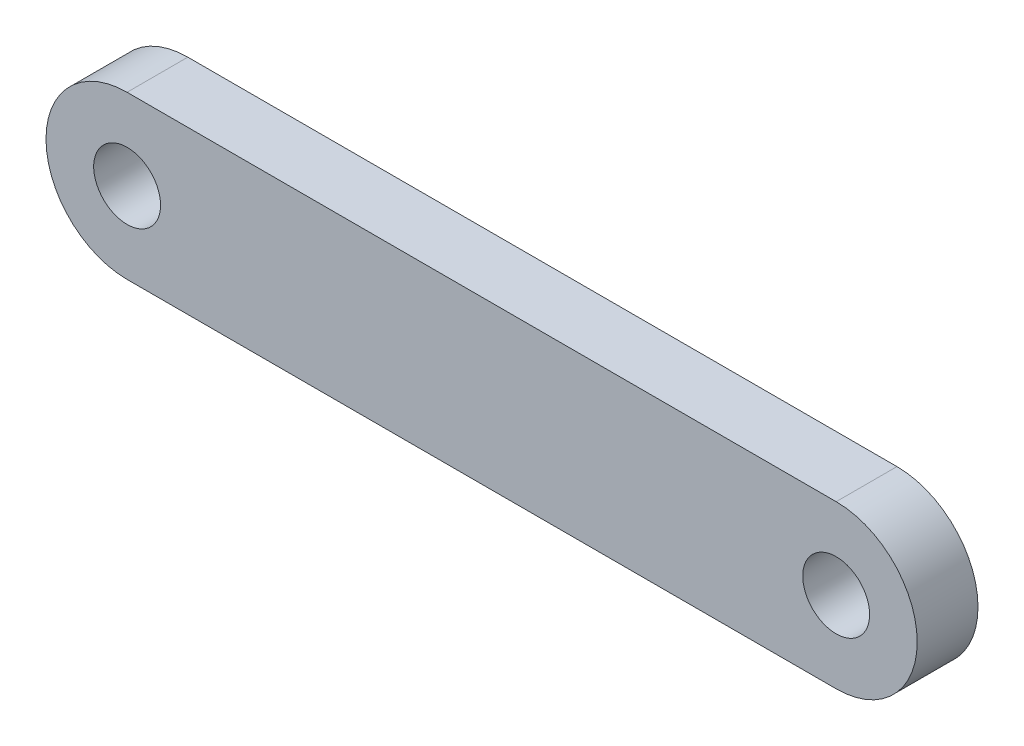
from build123d import *

# Parameters (mm, degrees)
SKETCH1_R           = 1.65
BOSS_EXTRUDE1_DEPTH = 3


with BuildPart() as part:
    # Sketch1 → Boss-Extrude1 (new body)
    with BuildSketch(Plane.XY):
        with BuildLine():
            Line((8.913568062, -38.860194395), (43.913568062, -38.860194395))
            ThreePointArc((43.913568062, -38.860194395), (47.913568062, -42.860194395), (43.913568062, -46.860194395))
            Line((43.913568062, -46.860194395), (8.913568062, -46.860194395))
            ThreePointArc((8.913568062, -46.860194395), (4.913568062, -42.860194395), (8.913568062, -38.860194395))
        make_face()
        with Locations((43.913568062, -42.860194395)):
            Circle(SKETCH1_R, mode=Mode.SUBTRACT)
        with Locations((8.916744392, -42.860194395)):
            Circle(SKETCH1_R, mode=Mode.SUBTRACT)
    extrude(amount=BOSS_EXTRUDE1_DEPTH)


solid = part.part
